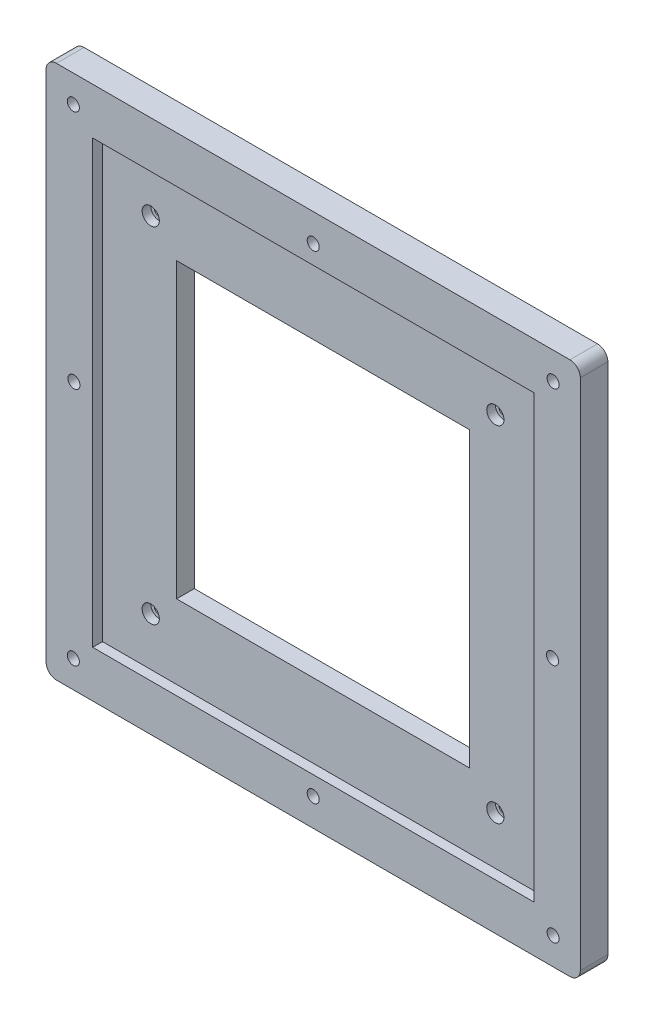
from build123d import *

# Parameters (mm, degrees)
SKETCH1_W           = 155
SKETCH1_H           = 155
SKETCH1_R           = 1.5
SKETCH1_W_2         = 85
SKETCH1_H_2         = 85
BOSS_EXTRUDE1_DEPTH = 8
SKETCH3_W           = 128
SKETCH3_H           = 128
CUT_EXTRUDE2_DEPTH  = 2.85
FILLET1_R           = 3
SKETCH4_R           = 2.5
CUT_EXTRUDE3_DEPTH  = 2.5
SKETCH5_R           = 1.75
CUT_EXTRUDE4_DEPTH  = 23
SKETCH6_R           = 3.35
CUT_EXTRUDE5_DEPTH  = 3.5


with BuildPart() as part:
    # Sketch1 → Boss-Extrude1 (new body)
    with BuildSketch(Plane.XY):
        Rectangle(SKETCH1_W, SKETCH1_H)
        with Locations((-50, 50)):
            Circle(SKETCH1_R, mode=Mode.SUBTRACT)
        with Locations((50, 50)):
            Circle(SKETCH1_R, mode=Mode.SUBTRACT)
        with Locations((50, -50)):
            Circle(SKETCH1_R, mode=Mode.SUBTRACT)
        with Locations((-50, -50)):
            Circle(SKETCH1_R, mode=Mode.SUBTRACT)
        Rectangle(SKETCH1_W_2, SKETCH1_H_2, mode=Mode.SUBTRACT)
    extrude(amount=BOSS_EXTRUDE1_DEPTH)

    # Sketch3 → Cut-Extrude2 (cut)
    with BuildSketch(Plane.XY.offset(8)):
        Rectangle(SKETCH3_W, SKETCH3_H)
    extrude(amount=-CUT_EXTRUDE2_DEPTH, mode=Mode.SUBTRACT)

    # Fillet1
    fillet1_edges = [part.edges().sort_by_distance(p)[0] for p in [
        (77.5, -77.5, 4),
        (-77.5, -77.5, 4),
        (-77.5, 77.5, 4),
        (77.5, 77.5, 4),
    ]]
    fillet(fillet1_edges, radius=FILLET1_R)

    # Sketch4 → Cut-Extrude3 (cut)
    with BuildSketch(Plane(origin=(0, 0, 5.15), x_dir=(-1, 0, 0), z_dir=(0, 0, -1))):
        with Locations((-50, 50)):
            Circle(SKETCH4_R)
        with Locations((50, 50)):
            Circle(SKETCH4_R)
        with Locations((50, -50)):
            Circle(SKETCH4_R)
        with Locations((-50, -50)):
            Circle(SKETCH4_R)
    extrude(amount=CUT_EXTRUDE3_DEPTH, mode=Mode.SUBTRACT)

    # Sketch5 → Cut-Extrude4 (cut)
    with BuildSketch(Plane.XY.offset(8)):
        with Locations((0, 69.431322576)):
            Circle(SKETCH5_R)
        with Locations((-69.610191061, 69.610191061)):
            Circle(SKETCH5_R)
        with Locations((69.431322576, 0)):
            Circle(SKETCH5_R)
        with Locations((69.610191061, 69.610191061)):
            Circle(SKETCH5_R)
        with Locations((0, -69.431322576)):
            Circle(SKETCH5_R)
        with Locations((69.610191061, -69.610191061)):
            Circle(SKETCH5_R)
        with Locations((-69.431322576, 0)):
            Circle(SKETCH5_R)
        with Locations((-69.610191061, -69.610191061)):
            Circle(SKETCH5_R)
    extrude(amount=-CUT_EXTRUDE4_DEPTH, mode=Mode.SUBTRACT)

    # Sketch6 → Cut-Extrude5 (cut)
    with BuildSketch(Plane(origin=(0, 0, 0), x_dir=(-1, 0, 0), z_dir=(0, 0, -1))):
        with Locations((-69.610191061, 69.610191061)):
            Circle(SKETCH6_R)
        with Locations((69.610191061, 69.610191061)):
            Circle(SKETCH6_R)
        with Locations((69.610191061, -69.610191061)):
            Circle(SKETCH6_R)
        with Locations((-69.610191061, -69.610191061)):
            Circle(SKETCH6_R)
        with Locations((-69.431322576, 0)):
            Circle(SKETCH6_R)
        with Locations((0, 69.431322576)):
            Circle(SKETCH6_R)
        with Locations((69.431322576, 0)):
            Circle(SKETCH6_R)
        with Locations((0, -69.431322576)):
            Circle(SKETCH6_R)
    extrude(amount=-CUT_EXTRUDE5_DEPTH, mode=Mode.SUBTRACT)


solid = part.part
